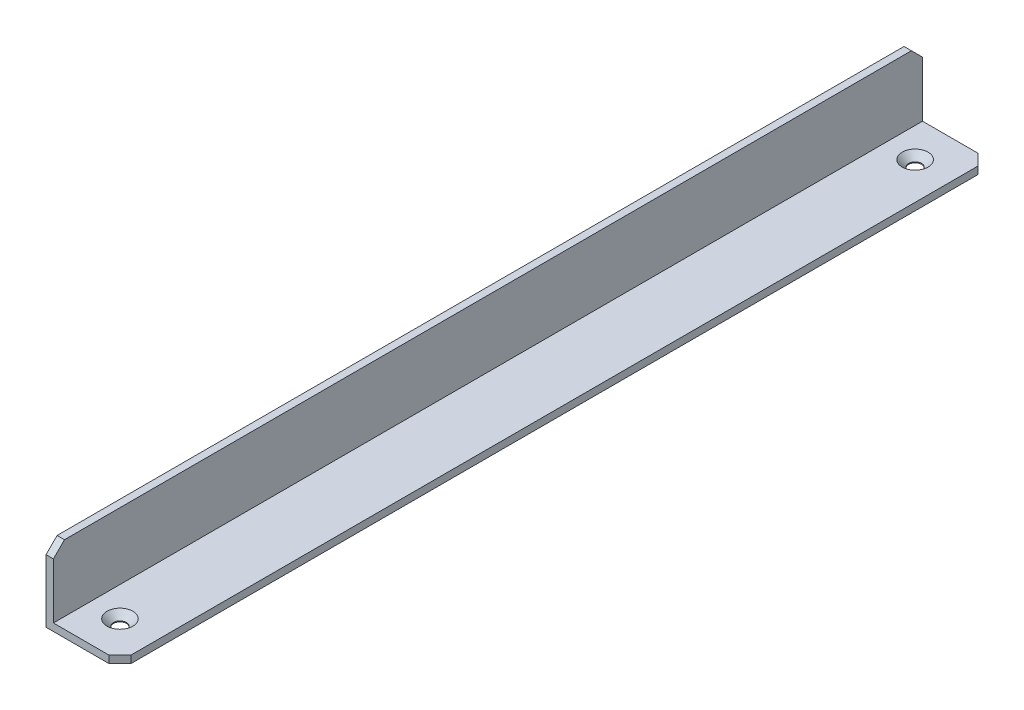
from build123d import *

# Parameters (mm, degrees)
BOSS_EXTRUDE1_DEPTH = 117.5
SKETCH3_R           = 1.75
CUT_EXTRUDE2_DEPTH  = 121.541486634
CHAMFER1_SIZE       = 3


with BuildPart() as part:
    # Sketch1 → Boss-Extrude1 (new, symmetric)
    with BuildSketch(Plane.XY):
        Polygon((0, 0), (20, 0), (20, 2), (2, 2), (2, 20), (0, 20), align=None)
    extrude(amount=BOSS_EXTRUDE1_DEPTH, both=True)

    # Cut-Extrude1 cone 1 section (through the dimple's axis) → Cut-Extrude1 (revolve, cut)
    with BuildSketch(Plane(origin=(10, 2, -107.5), x_dir=(0, 0, 1), z_dir=(1, 0, 0))):
        Polygon((0, 0), (3.5, 0), (0, 3.5), align=None)
    revolve(axis=Axis((10, 2, -107.5), (0, -1, 0)), mode=Mode.SUBTRACT)

    # Cut-Extrude1 cone 2 section (through the dimple's axis) → Cut-Extrude1 cone 2 (revolve, cut)
    with BuildSketch(Plane(origin=(10, 2, 107.5), x_dir=(0, 0, 1), z_dir=(1, 0, 0))):
        Polygon((0, 0), (3.5, 0), (0, 3.5), align=None)
    revolve(axis=Axis((10, 2, 107.5), (0, -1, 0)), mode=Mode.SUBTRACT)

    # Sketch3 → Cut-Extrude2 (cut, through all)
    with BuildSketch(Plane(origin=(0, 2, 0), x_dir=(1, 0, 0), z_dir=(0, 1, 0))):
        with Locations(Location((10, -107.5, 0), (0, 0, 180))):
            Circle(SKETCH3_R)
        with Locations(Location((10, 107.5, 0), (0, 0, 180))):
            Circle(SKETCH3_R)
    extrude(amount=-CUT_EXTRUDE2_DEPTH, mode=Mode.SUBTRACT)

    # Chamfer1
    chamfer1_edges = [part.edges().sort_by_distance(p)[0] for p in [
        (20, 1, 117.5),
        (1, 20, 117.5),
        (1, 20, -117.5),
        (20, 1, -117.5),
    ]]
    chamfer(chamfer1_edges, length=CHAMFER1_SIZE)


solid = part.part
